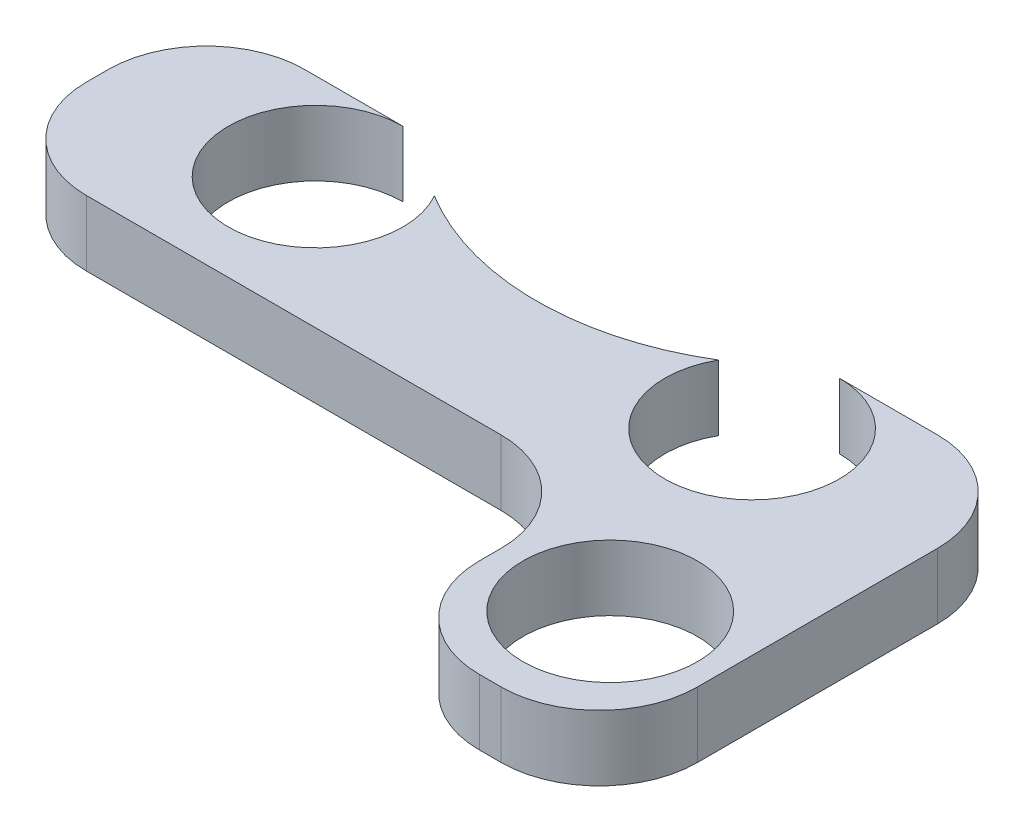
from build123d import *

# Parameters (mm, degrees)
SKETCH1_R           = 4
BOSS_EXTRUDE1_DEPTH = 1.5


with BuildPart() as part:
    # Sketch1 → Boss-Extrude1 (new, symmetric)
    with BuildSketch(Plane(origin=(0, 0, 0), x_dir=(1, 0, 0), z_dir=(0, 1, 0))):
        with BuildLine():
            Line((-10, -8.624404748), (-14.5, -8.624404748))
            ThreePointArc((-14.5, -8.624404748), (-17.681980515, -9.942424233), (-19, -13.124404748))
            Line((-19, -13.124404748), (-19, -14.124404748))
            ThreePointArc((-19, -14.124404748), (-17.681980515, -17.306385264), (-14.5, -18.624404748))
            Line((-14.5, -18.624404748), (4.5, -18.624404748))
            ThreePointArc((4.5, -18.624404748), (7.681980515, -19.942424233), (9, -23.124404748))
            Line((9, -23.124404748), (9, -24.124404748))
            ThreePointArc((9, -24.124404748), (10.318019485, -27.306385264), (13.5, -28.624404748))
            Line((13.5, -28.624404748), (14.5, -28.624404748))
            ThreePointArc((14.5, -28.624404748), (17.681980515, -27.306385264), (19, -24.124404748))
            Line((19, -24.124404748), (19, -13.124404748))
            ThreePointArc((19, -13.124404748), (17.681980515, -9.942424233), (14.5, -8.624404748))
            Line((14.5, -8.624404748), (10, -8.624404748))
            ThreePointArc((10, -8.624404748), (12.023420987, -16.074878268), (6.509119733, -10.671520993))
            ThreePointArc((6.509119733, -10.671520993), (0, -12.5), (-6.509119733, -10.671520993))
            ThreePointArc((-6.509119733, -10.671520993), (-12.023420987, -16.074878268), (-10, -8.624404748))
        make_face()
        with Locations(Location((14, -23.124404748, 0), (0, 0, 270))):
            Circle(SKETCH1_R, mode=Mode.SUBTRACT)
    extrude(amount=BOSS_EXTRUDE1_DEPTH, both=True)


solid = part.part
